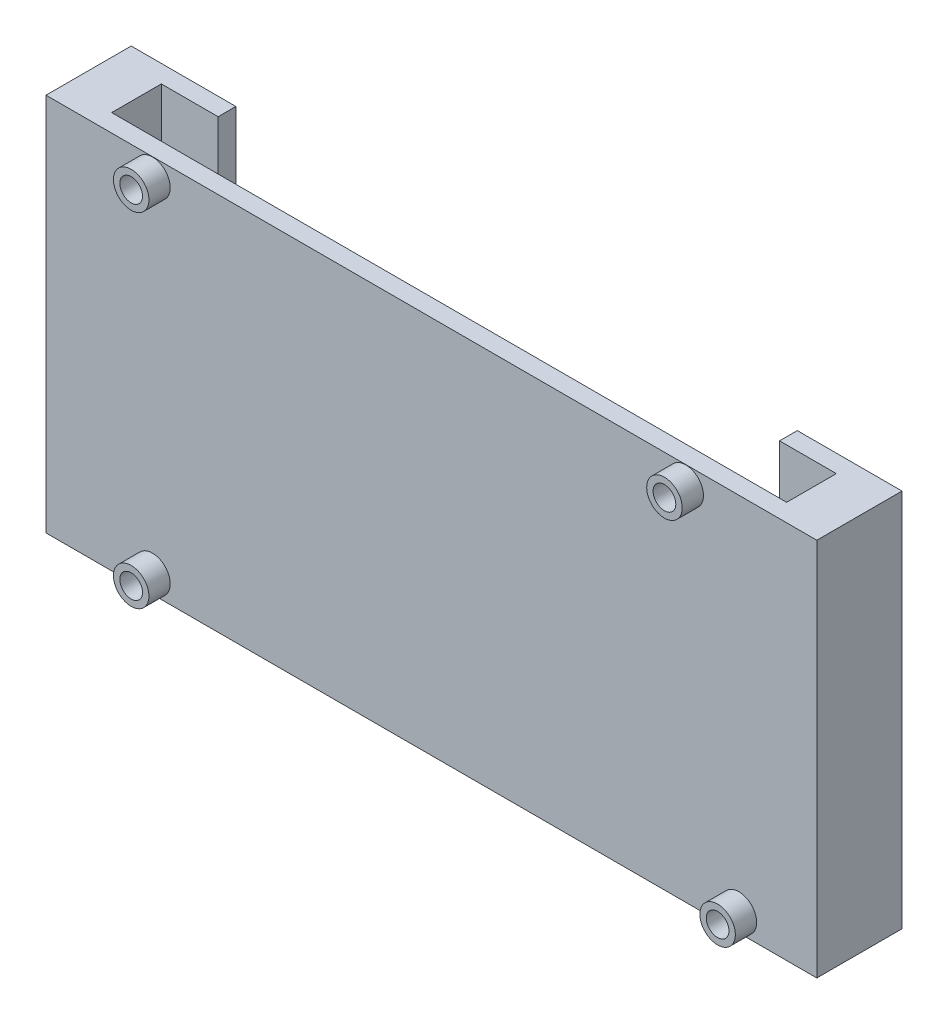
from build123d import *

# Parameters (mm, degrees)
SKETCH1_W            = 108.6
SKETCH1_H            = 53.4162
BOSS_EXTRUDE1_DEPTH  = 2.5
SKETCH2_R            = 2.5
BOSS_EXTRUDE2_DEPTH  = 3
M3_CLEARANCE_HOLE1_D = 3.2
SKETCH5_W            = 6.75
SKETCH5_H            = 53.4162
BOSS_EXTRUDE3_DEPTH  = 9.5
SKETCH6_W            = 2.5
SKETCH6_H            = 53.4162
BOSS_EXTRUDE4_DEPTH  = 8
SKETCH7_W            = 2.5
SKETCH7_H            = 53.4162
BOSS_EXTRUDE5_DEPTH  = 8
SKETCH8_R            = 3.15
CUT_EXTRUDE1_DEPTH   = 2.7


with BuildPart() as part:
    # Sketch1 → Boss-Extrude1 (new body)
    with BuildSketch(Plane.XY):
        Rectangle(SKETCH1_W, SKETCH1_H)
    extrude(amount=BOSS_EXTRUDE1_DEPTH)

    # Sketch2 → Boss-Extrude2 (add)
    with BuildSketch(Plane.XY.offset(2.5)):
        with Locations(Location((-39.3, 24.1681, 0), (0, 0, 180))):
            Circle(SKETCH2_R)
        with Locations(Location((35.83, 24.1681, 0), (0, 0, 180))):
            Circle(SKETCH2_R)
        with Locations(Location((43.32, -24.16810902, 0), (0, 0, 180))):
            Circle(SKETCH2_R)
        with Locations(Location((-39.3, -24.16810902, 0), (0, 0, 180))):
            Circle(SKETCH2_R)
    extrude(amount=BOSS_EXTRUDE2_DEPTH)

    # M3 Clearance Hole1 (through all)
    with Locations(Plane.XY.offset(5.5)):
        with Locations((-39.3, 24.1681), (35.83, 24.1681), (43.32, -24.16810902), (-39.3, -24.16810902)):
            Hole(M3_CLEARANCE_HOLE1_D / 2)

    # Sketch5 → Boss-Extrude3 (add)
    with BuildSketch(Plane(origin=(0, 0, 0), x_dir=(-1, 0, 0), z_dir=(0, 0, -1))):
        with Locations((-50.925, 0)):
            Rectangle(SKETCH5_W, SKETCH5_H)
        with Locations((50.925, 0)):
            Rectangle(SKETCH5_W, SKETCH5_H)
    extrude(amount=BOSS_EXTRUDE3_DEPTH)

    # Sketch6 → Boss-Extrude4 (add)
    with BuildSketch(Plane.ZY.offset(-47.55)):
        with Locations((-8.25, 0)):
            Rectangle(SKETCH6_W, SKETCH6_H)
    extrude(amount=BOSS_EXTRUDE4_DEPTH)

    # Sketch7 → Boss-Extrude5 (add)
    with BuildSketch(Plane(origin=(-47.55, 0, 0), x_dir=(0, 0, -1), z_dir=(1, 0, 0))):
        with Locations((8.25, 0)):
            Rectangle(SKETCH7_W, SKETCH7_H)
    extrude(amount=BOSS_EXTRUDE5_DEPTH)

    # Sketch8 → Cut-Extrude1 (cut)
    with BuildSketch(Plane.XZ.offset(26.7081)):
        with Locations(Location((-50.925, -3.5, 0), (0, 0, 270))):
            Circle(SKETCH8_R)
        with Locations(Location((50.925, -3.5, 0), (0, 0, 270))):
            Circle(SKETCH8_R)
    extrude(amount=-CUT_EXTRUDE1_DEPTH, mode=Mode.SUBTRACT)


solid = part.part
